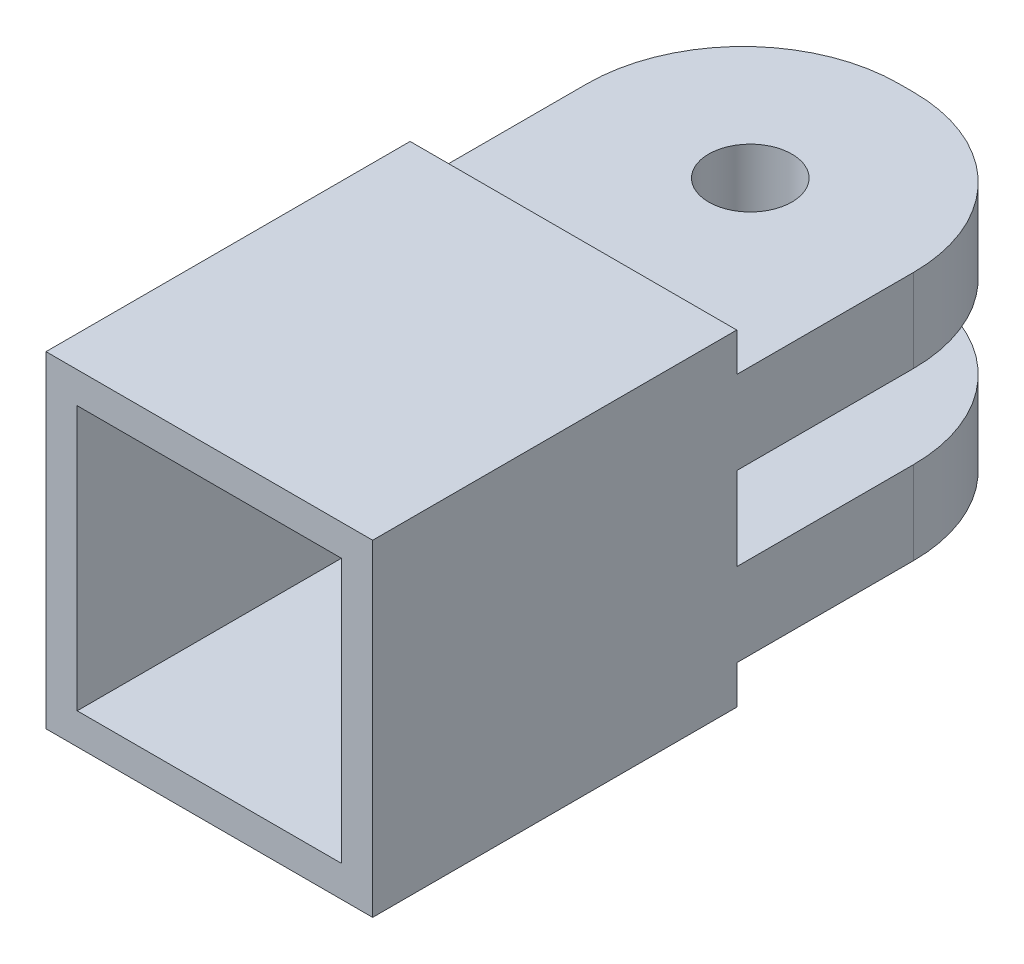
from build123d import *

# Parameters (mm, degrees)
SKETCH1_W           = 31.4
SKETCH1_H           = 31.4
SKETCH1_W_2         = 25.4
SKETCH1_H_2         = 25.4
BOSS_EXTRUDE1_DEPTH = 30
SKETCH2_W           = 31.4
SKETCH2_H           = 31.4
BOSS_EXTRUDE2_DEPTH = 5
SKETCH3_W           = 31.4
SKETCH3_H           = 8
BOSS_EXTRUDE3_DEPTH = 5
SKETCH6_R           = 4
BOSS_EXTRUDE6_DEPTH = 8


with BuildPart() as part:
    # Sketch1 → Boss-Extrude1 (new body)
    with BuildSketch(Plane.XY):
        Rectangle(SKETCH1_W, SKETCH1_H)
        Rectangle(SKETCH1_W_2, SKETCH1_H_2, mode=Mode.SUBTRACT)
    extrude(amount=BOSS_EXTRUDE1_DEPTH)

    # Sketch2 → Boss-Extrude2 (add)
    with BuildSketch(Plane(origin=(0, 0, 0), x_dir=(-1, 0, 0), z_dir=(0, 0, -1))):
        Rectangle(SKETCH2_W, SKETCH2_H)
    extrude(amount=BOSS_EXTRUDE2_DEPTH)

    # Sketch3 → Boss-Extrude3 (add)
    with BuildSketch(Plane(origin=(0, 0, -5), x_dir=(-1, 0, 0), z_dir=(0, 0, -1))):
        with Locations((0, 8)):
            Rectangle(SKETCH3_W, SKETCH3_H)
    boss_extrude3 = extrude(amount=BOSS_EXTRUDE3_DEPTH)

    # Sketch6 → Boss-Extrude6 (add)
    with BuildSketch(Plane(origin=(0, 12, 0), x_dir=(1, 0, 0), z_dir=(0, 1, 0))):
        with BuildLine():
            Line((-15.7, 10), (-15.7, 22))
            ThreePointArc((-15.7, 22), (-11.306601718, 32.606601718), (-0.7, 37))
            Line((-0.7, 37), (0.7, 37))
            ThreePointArc((0.7, 37), (11.306601718, 32.606601718), (15.7, 22))
            Line((15.7, 22), (15.7, 10))
            Line((15.7, 10), (-15.7, 10))
        make_face()
        with Locations(Location((0, 22, 0), (0, 0, 270))):
            Circle(SKETCH6_R, mode=Mode.SUBTRACT)
    boss_extrude6 = extrude(amount=-BOSS_EXTRUDE6_DEPTH)

    # Mirror1: Boss-Extrude3, Boss-Extrude6 across plane
    add(boss_extrude3.mirror(Plane.ZX))
    add(boss_extrude6.mirror(Plane.ZX))


solid = part.part
